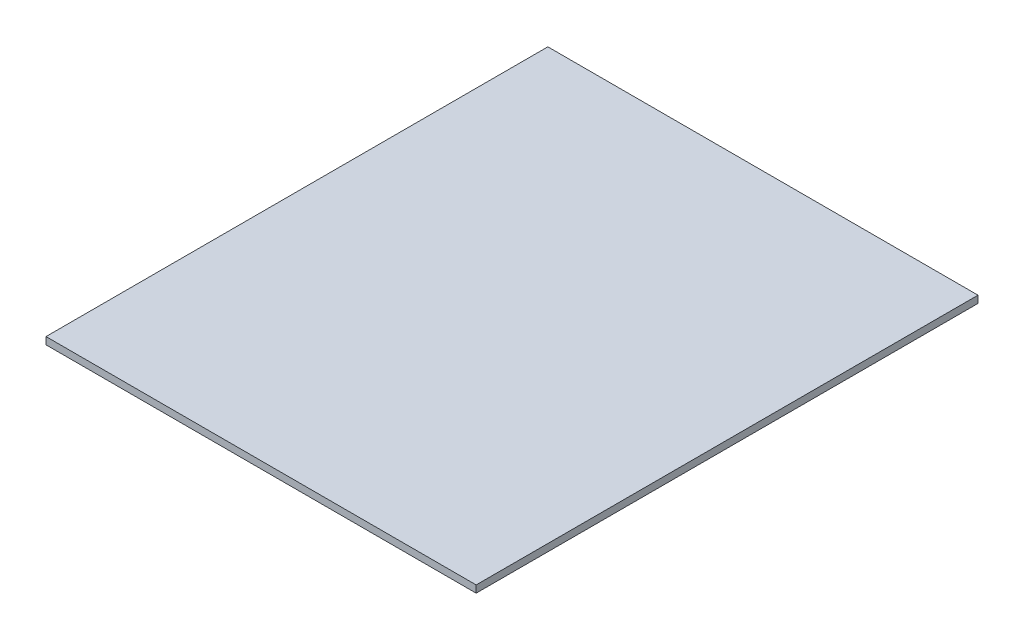
from build123d import *

# Parameters (mm, degrees)
ESBO_O1_W                = 3000
ESBO_O1_H                = 3500
RESSALTO_EXTRUS_O1_DEPTH = 50


with BuildPart() as part:
    # Esboço1 → Ressalto-extrusão1 (new body)
    with BuildSketch(Plane(origin=(0, 0, 0), x_dir=(1, 0, 0), z_dir=(0, 1, 0))):
        Rectangle(ESBO_O1_W, ESBO_O1_H)
    extrude(amount=RESSALTO_EXTRUS_O1_DEPTH)


solid = part.part
